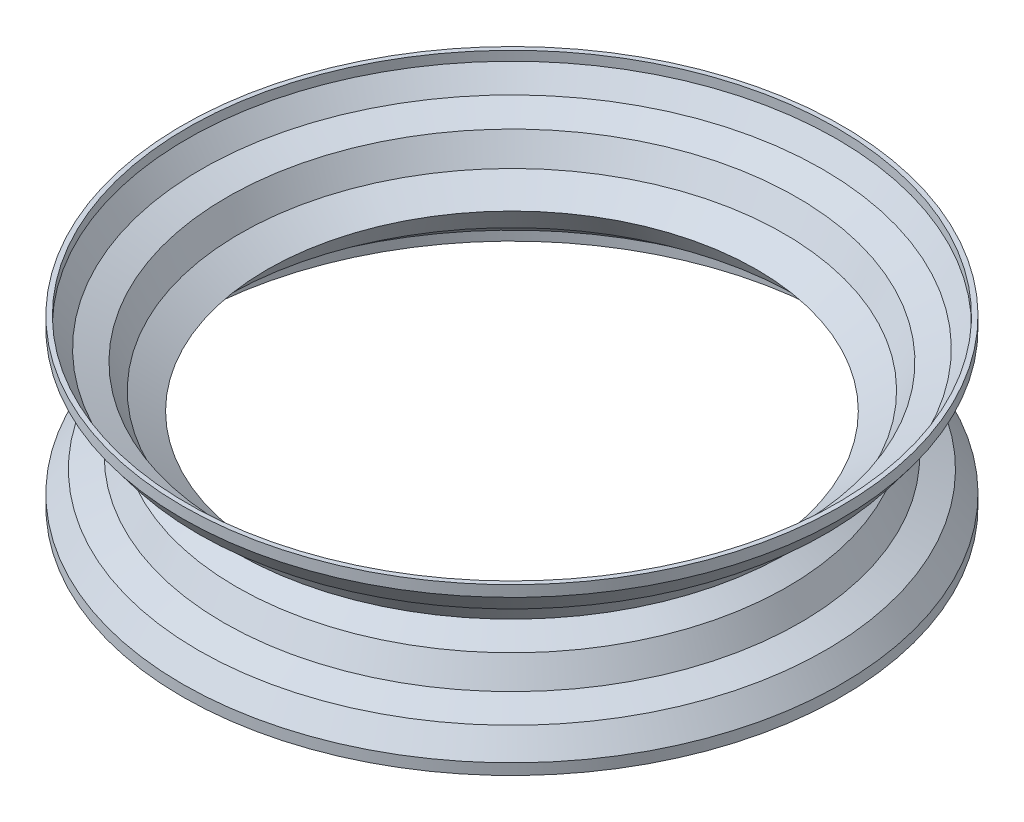
from build123d import *

# Parameters (mm, degrees)
SKETCH_1_R      = 35.893803705
EXTRUDE_1_DEPTH = 1.2
SHELL_1_T       = -0.5


with BuildPart() as part:
    # 스케치1 → 보스-돌출1 (new body)
    with BuildSketch(Plane(origin=(0, 0, 0), x_dir=(1, 0, 0), z_dir=(0, 1, 0))):
        with Locations(Location((0, 0, 0), (0, 0, 270))):
            Circle(SKETCH_1_R)
    extrude_1 = extrude(amount=EXTRUDE_1_DEPTH)

    # 스케치4 → 회전1 (revolve)
    with BuildSketch(Plane(origin=(0, 0, 0), x_dir=(0, 0, -1), z_dir=(1, 0, 0))):
        Polygon((-35.893803705, 1.2), (-34.159836859, 3.514461722), (-31.398977187, 4.735538278), (-30.00730795, 7.414461722), (-27.588745887, 9), (0, 9), (0, 1.2), align=None)
    revolve_1 = revolve(axis=Axis((0, 9, 0), (0, -1, 0)))

    # 대칭 복사1: 보스-돌출1, 회전1 across plane
    add(extrude_1.mirror(Plane(origin=(0, 9, 27.588745887), x_dir=(0, 0, 1), z_dir=(0, 1, 0))))
    add(revolve_1.mirror(Plane(origin=(0, 9, 27.588745887), x_dir=(0, 0, 1), z_dir=(0, 1, 0))))

    # 쉘1
    shell_1_openings = [part.faces().sort_by_distance(p)[0] for p in [
        (0, 18, 0),
        (0, 0, 0),
    ]]
    offset(amount=SHELL_1_T, openings=shell_1_openings, kind=Kind.INTERSECTION)


solid = part.part
